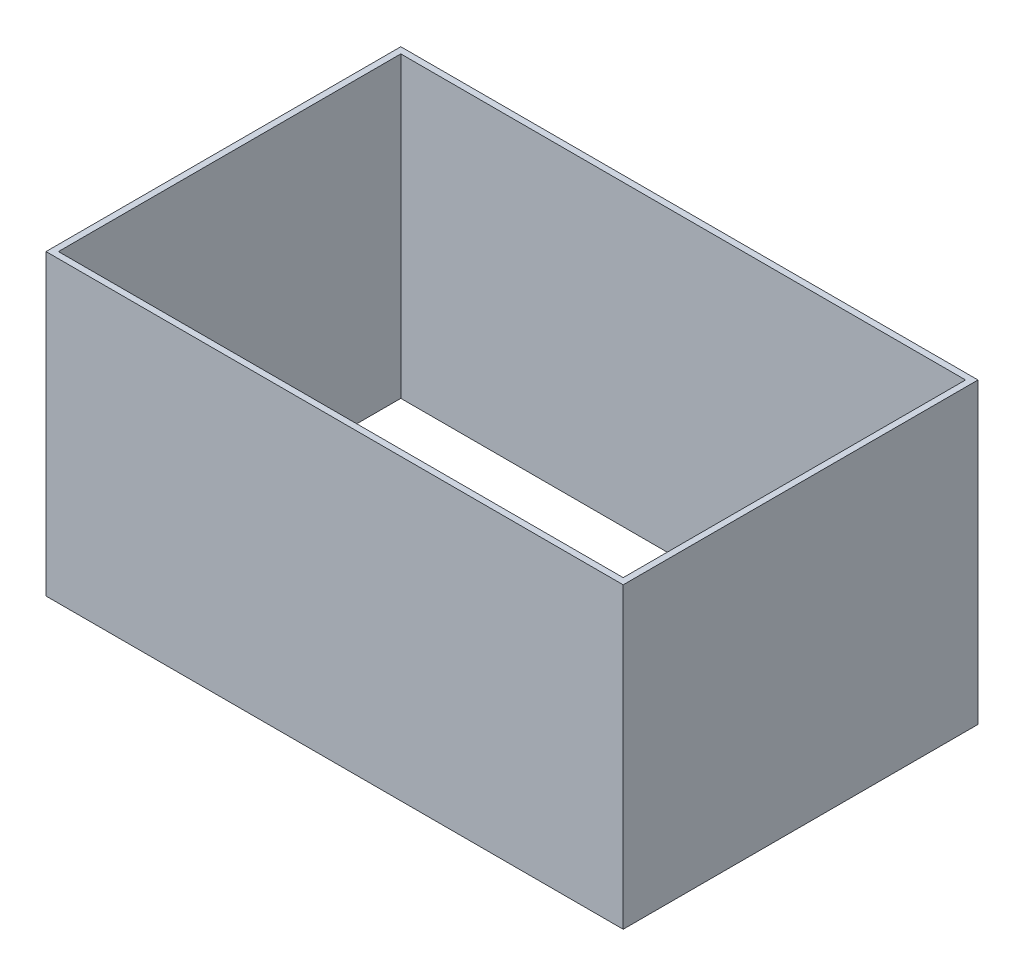
from build123d import *

# Parameters (mm, degrees)
SKETCH1_W           = 235.88610364
SKETCH1_H           = 144.997240468
SKETCH1_W_2         = 230.80610364
SKETCH1_H_2         = 139.917240468
EXTRUDE_THIN1_DEPTH = 121.92


with BuildPart() as part:
    # Sketch1 → Extrude-Thin1 (new body)
    with BuildSketch(Plane(origin=(0, 0, 0), x_dir=(1, 0, 0), z_dir=(0, 1, 0))):
        Rectangle(SKETCH1_W, SKETCH1_H)
        Rectangle(SKETCH1_W_2, SKETCH1_H_2, mode=Mode.SUBTRACT)
    extrude(amount=EXTRUDE_THIN1_DEPTH)


solid = part.part
